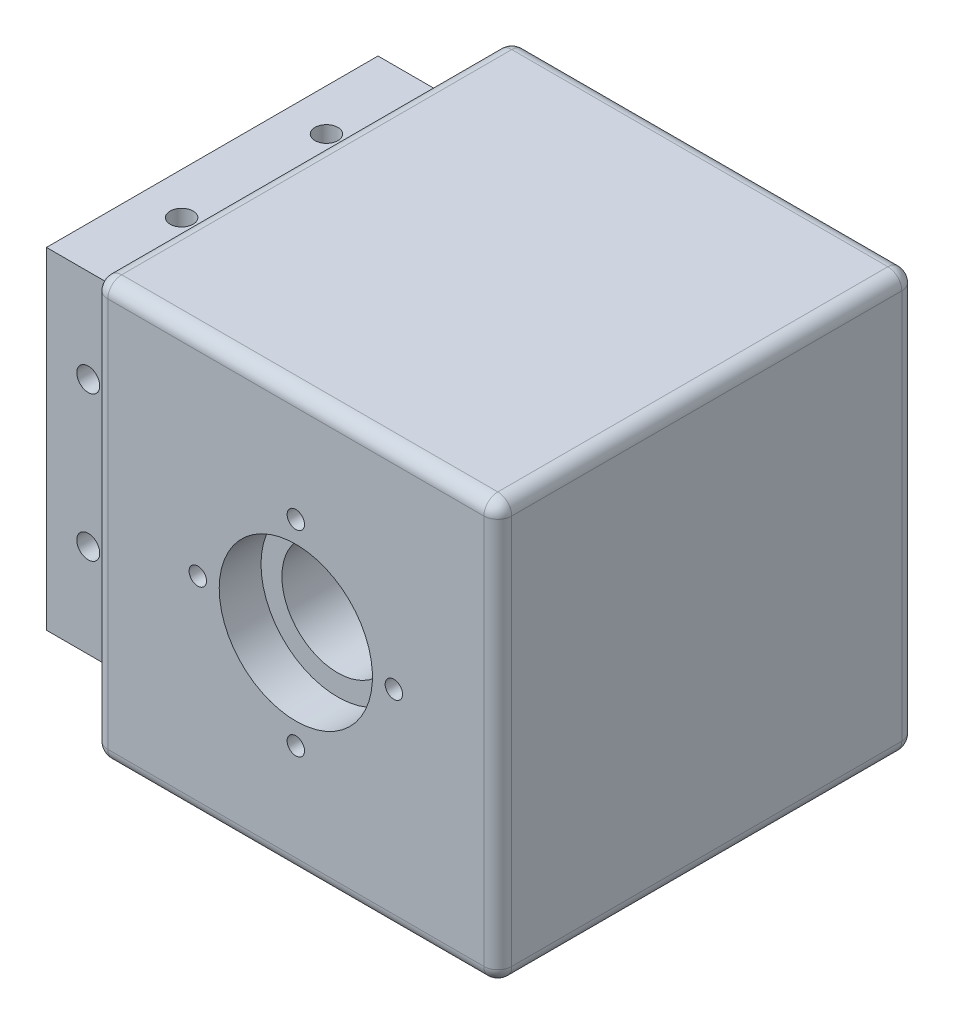
from build123d import *

# Parameters (mm, degrees)
SKETCH1_W                  = 60
SKETCH1_H                  = 60
BOSS_EXTRUDE1_DEPTH        = 80
CUT_EXTRUDE2_START         = -16
SKETCH3_R                  = 11
CUT_EXTRUDE2_DEPTH         = 107.553851381
SKETCH4_OUTSIDE_W          = 105.324
SKETCH4_OUTSIDE_H          = 85.324
SKETCH4_OUTSIDE_W_2        = 47.6
SKETCH4_OUTSIDE_H_2        = 47.6
CUT_EXTRUDE5_DEPTH         = 13
M4_TAPPED_HOLE2_AT_2_COUNT = 2
M4_TAPPED_HOLE2_AT_2_PITCH = 20.8
CIRPATTERN2_COUNT          = 4
CIRPATTERN4_COUNT          = 4
SKETCH21_R                 = 8
CUT_EXTRUDE6_DEPTH         = 77.785415282
SKETCH24_W                 = 10
SKETCH24_H                 = 60
CUT_EXTRUDE7_DEPTH         = 53
SKETCH25_W                 = 60
SKETCH25_H                 = 60
BOSS_EXTRUDE2_DEPTH        = 11
FILLET1_R                  = 2


with BuildPart() as part:
    # Sketch1 → Boss-Extrude1 (new body)
    with BuildSketch(Plane.XY):
        Rectangle(SKETCH1_W, SKETCH1_H)
    extrude(amount=BOSS_EXTRUDE1_DEPTH)

    # Sketch3 → Cut-Extrude2 (cut)
    with BuildSketch(Plane(origin=(0, 0, 0), x_dir=(-1, 0, 0), z_dir=(0, 0, -1)).offset(CUT_EXTRUDE2_START)):
        with Locations(Location((-12, 0, 0), (0, 0, 180))):
            Circle(SKETCH3_R)
    cut_extrude2 = extrude(amount=CUT_EXTRUDE2_DEPTH, mode=Mode.SUBTRACT)

    # Sketch4 outside → Cut-Extrude5 (cut)
    with BuildSketch(Plane.ZY.offset(30)):
        with Locations((40, 0)):
            Rectangle(SKETCH4_OUTSIDE_W, SKETCH4_OUTSIDE_H)
        with Locations((40, 0)):
            Rectangle(SKETCH4_OUTSIDE_W_2, SKETCH4_OUTSIDE_H_2, mode=Mode.SUBTRACT)
    extrude(amount=-CUT_EXTRUDE5_DEPTH, mode=Mode.SUBTRACT)

    # Sketch19 → M4 Tapped Hole2 (revolve, cut)
    with BuildSketch(Plane(origin=(-24, -23.8, 29.6), x_dir=(0, 0, -1), z_dir=(1, 0, 0))):
        Polygon((0, 0), (0, 12.491420021), (1.65, 11.5), (1.65, 0), align=None)
    m4_tapped_hole2 = revolve(axis=Axis((-24, -30.15, 29.6), (0, 1, 0)), mode=Mode.SUBTRACT)

    # M4 Tapped Hole2 at 2: M4 Tapped Hole2 ×2
    with Locations(*[(0, 0, i * M4_TAPPED_HOLE2_AT_2_PITCH) for i in range(1, M4_TAPPED_HOLE2_AT_2_COUNT)]):
        add(m4_tapped_hole2, mode=Mode.SUBTRACT)

    # CirPattern2: M4 Tapped Hole2 ×4 about axis
    cirpattern2_axis = Axis((-30, 0, 40), (1, 0, 0))
    for i in range(1, CIRPATTERN2_COUNT):
        add(m4_tapped_hole2.rotate(cirpattern2_axis, i * 360 / CIRPATTERN2_COUNT), mode=Mode.SUBTRACT)

    # CirPattern2 copy 1 sketch → CirPattern2 copy 1 (revolve, cut)
    with BuildSketch(Plane(origin=(-24, -10.4, 16.2), x_dir=(0, 1, 0), z_dir=(1, 0, 0))):
        Polygon((0, 0), (0, 12.491420021), (1.65, 11.5), (1.65, 0), align=None)
    revolve(axis=Axis((-24, -10.4, 9.85), (0, 0, 1)), mode=Mode.SUBTRACT)

    # CirPattern2 copy 2 sketch → CirPattern2 copy 2 (revolve, cut)
    with BuildSketch(Plane(origin=(-24, 23.8, 29.6), x_dir=(0, 0, 1), z_dir=(1, 0, 0))):
        Polygon((0, 0), (0, 12.491420021), (1.65, 11.5), (1.65, 0), align=None)
    revolve(axis=Axis((-24, 30.15, 29.6), (0, -1, 0)), mode=Mode.SUBTRACT)

    # CirPattern2 copy 3 sketch → CirPattern2 copy 3 (revolve, cut)
    with BuildSketch(Plane(origin=(-24, 10.4, 63.8), x_dir=(0, -1, 0), z_dir=(1, 0, 0))):
        Polygon((0, 0), (0, 12.491420021), (1.65, 11.5), (1.65, 0), align=None)
    revolve(axis=Axis((-24, 10.4, 70.15), (0, 0, -1)), mode=Mode.SUBTRACT)

    # Mirror2: Cut-Extrude2 across plane
    add(cut_extrude2.mirror(Plane(origin=(0, 0, 40), x_dir=(1, 0, 0), z_dir=(0, 0, -1))), mode=Mode.SUBTRACT)

    # Sketch23 → M3 Tapped Hole1 (revolve, cut)
    with BuildSketch(Plane.YZ.offset(26.073090354)):
        Polygon((0, 0), (0, 25.751075774), (1.25, 25), (1.25, 0), align=None)
    m3_tapped_hole1 = revolve(axis=Axis((26.073090354, 0, -6.35), (0, 0, 1)), mode=Mode.SUBTRACT)

    # CirPattern4: M3 Tapped Hole1 ×4 about axis
    cirpattern4_axis = Axis((12, 0, 0), (0, 0, 1))
    for i in range(1, CIRPATTERN4_COUNT):
        add(m3_tapped_hole1.rotate(cirpattern4_axis, i * 360 / CIRPATTERN4_COUNT), mode=Mode.SUBTRACT)

    # Mirror3: M3 Tapped Hole1 across plane
    add(m3_tapped_hole1.mirror(Plane(origin=(0, 0, 40), x_dir=(1, 0, 0), z_dir=(0, 0, -1))), mode=Mode.SUBTRACT)

    # Mirror3 copy 1 sketch → Mirror3 copy 1 (revolve, cut)
    with BuildSketch(Plane(origin=(12, 14.073090354, 80), x_dir=(-1, 0, 0), z_dir=(0, 1, 0))):
        Polygon((0, 0), (0, -25.751075774), (1.25, -25), (1.25, 0), align=None)
    revolve(axis=Axis((12, 14.073090354, 86.35), (0, 0, 1)), mode=Mode.SUBTRACT)

    # Mirror3 copy 2 sketch → Mirror3 copy 2 (revolve, cut)
    with BuildSketch(Plane(origin=(-2.073090354, 0, 80), x_dir=(0, -1, 0), z_dir=(-1, 0, 0))):
        Polygon((0, 0), (0, -25.751075774), (1.25, -25), (1.25, 0), align=None)
    revolve(axis=Axis((-2.073090354, 0, 86.35), (0, 0, 1)), mode=Mode.SUBTRACT)

    # Mirror3 copy 3 sketch → Mirror3 copy 3 (revolve, cut)
    with BuildSketch(Plane(origin=(12, -14.073090354, 80), x_dir=(1, 0, 0), z_dir=(0, -1, 0))):
        Polygon((0, 0), (0, -25.751075774), (1.25, -25), (1.25, 0), align=None)
    revolve(axis=Axis((12, -14.073090354, 86.35), (0, 0, 1)), mode=Mode.SUBTRACT)

    # Sketch21 → Cut-Extrude6 (cut, through all)
    with BuildSketch(Plane(origin=(0, 0, 16), x_dir=(-1, 0, 0), z_dir=(0, 0, -1))):
        with Locations((-12, 0)):
            Circle(SKETCH21_R)
    extrude(amount=-CUT_EXTRUDE6_DEPTH, mode=Mode.SUBTRACT)

    # Sketch24 → Cut-Extrude7 (cut)
    with BuildSketch(Plane(origin=(30, 0, 0), x_dir=(0, 0, -1), z_dir=(1, 0, 0))):
        with Locations((-5, 0)):
            Rectangle(SKETCH24_W, SKETCH24_H)
        with Locations((-75, 0)):
            Rectangle(SKETCH24_W, SKETCH24_H)
    extrude(amount=-CUT_EXTRUDE7_DEPTH, mode=Mode.SUBTRACT)

    # Sketch25 → Boss-Extrude2 (add)
    with BuildSketch(Plane(origin=(30, 0, 0), x_dir=(0, 0, -1), z_dir=(1, 0, 0))):
        with Locations((-40, 0)):
            Rectangle(SKETCH25_W, SKETCH25_H)
    extrude(amount=BOSS_EXTRUDE2_DEPTH)

    # Fillet1
    fillet1_edges = [part.edges().sort_by_distance(p)[0] for p in [
        (-17, 30, 40),
        (-17, -30, 40),
        (-17, 0, 10),
        (12, -30, 10),
        (12, 30, 10),
        (-17, 0, 70),
        (12, 30, 70),
        (12, -30, 70),
        (41, 0, 10),
        (41, 30, 40),
        (41, 0, 70),
        (41, -30, 40),
    ]]
    fillet(fillet1_edges, radius=FILLET1_R)


solid = part.part
